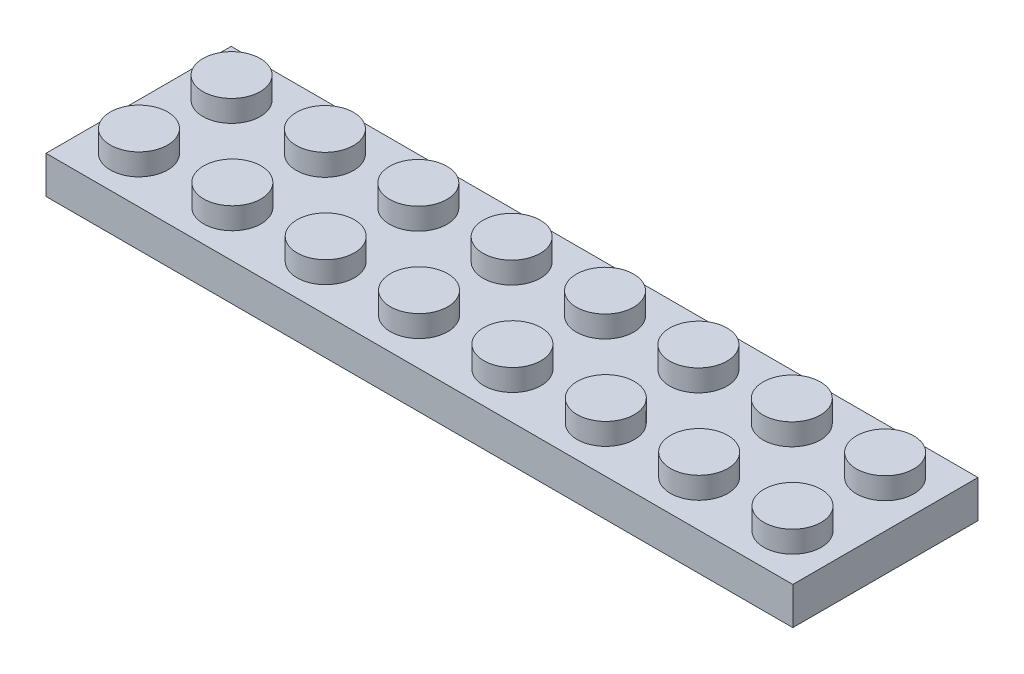
from build123d import *

# Parameters (mm, degrees)
SKETCH1_W           = 63.83
SKETCH1_H           = 15.83
BOSS_EXTRUDE1_DEPTH = 3.2
SKETCH2_R           = 2.45
BOSS_EXTRUDE2_DEPTH = 1.85
SHELL1_T            = -1.5
SKETCH3_R           = 3.24
SKETCH3_R_2         = 2.43
BOSS_EXTRUDE3_DEPTH = 1.5


with BuildPart() as part:
    # Sketch1 → Boss-Extrude1 (new body)
    with BuildSketch(Plane(origin=(0, 0, 0), x_dir=(1, 0, 0), z_dir=(0, 1, 0))):
        Rectangle(SKETCH1_W, SKETCH1_H)
    extrude(amount=-BOSS_EXTRUDE1_DEPTH)

    # Sketch2 → Boss-Extrude2 (add)
    with BuildSketch(Plane(origin=(0, 0, 0), x_dir=(1, 0, 0), z_dir=(0, 1, 0))):
        with Locations(Location((-27.925625, 3.9575, 0), (0, 0, 270))):
            Circle(SKETCH2_R)
        with Locations(Location((-19.945625, 3.9575, 0), (0, 0, 270))):
            Circle(SKETCH2_R)
        with Locations(Location((-11.965625, 3.9575, 0), (0, 0, 270))):
            Circle(SKETCH2_R)
        with Locations(Location((-3.985625, 3.9575, 0), (0, 0, 270))):
            Circle(SKETCH2_R)
        with Locations(Location((3.994375, 3.9575, 0), (0, 0, 270))):
            Circle(SKETCH2_R)
        with Locations(Location((11.974375, 3.9575, 0), (0, 0, 270))):
            Circle(SKETCH2_R)
        with Locations(Location((19.954375, 3.9575, 0), (0, 0, 270))):
            Circle(SKETCH2_R)
        with Locations(Location((27.934375, 3.9575, 0), (0, 0, 270))):
            Circle(SKETCH2_R)
        with Locations(Location((27.934375, -3.9575, 0), (0, 0, 90))):
            Circle(SKETCH2_R)
        with Locations(Location((19.954375, -3.9575, 0), (0, 0, 90))):
            Circle(SKETCH2_R)
        with Locations(Location((11.974375, -3.9575, 0), (0, 0, 90))):
            Circle(SKETCH2_R)
        with Locations(Location((3.994375, -3.9575, 0), (0, 0, 90))):
            Circle(SKETCH2_R)
        with Locations(Location((-3.985625, -3.9575, 0), (0, 0, 90))):
            Circle(SKETCH2_R)
        with Locations(Location((-11.965625, -3.9575, 0), (0, 0, 90))):
            Circle(SKETCH2_R)
        with Locations(Location((-19.945625, -3.9575, 0), (0, 0, 90))):
            Circle(SKETCH2_R)
        with Locations(Location((-27.925625, -3.9575, 0), (0, 0, 90))):
            Circle(SKETCH2_R)
    extrude(amount=BOSS_EXTRUDE2_DEPTH)

    # Shell1
    shell1_openings = [part.faces().sort_by_distance(p)[0] for p in [
        (0, -3.2, 0),
    ]]
    offset(amount=SHELL1_T, openings=shell1_openings, kind=Kind.INTERSECTION)

    # Sketch3 → Boss-Extrude3 (add)
    # profile 1 of 7: a face of its own
    with BuildSketch(Plane.XZ.offset(1.5)):
        with Locations(Location((-23.93625, 0, 0), (0, 0, 90))):
            Circle(SKETCH3_R)
        with Locations(Location((-23.93625, 0, 0), (0, 0, 90))):
            Circle(SKETCH3_R_2, mode=Mode.SUBTRACT)
    # profile 2 of 7: a face of its own
    with BuildSketch(Plane.XZ.offset(1.5)):
        with Locations(Location((-15.95625, 0, 0), (0, 0, 90))):
            Circle(SKETCH3_R)
        with Locations(Location((-15.95625, 0, 0), (0, 0, 90))):
            Circle(SKETCH3_R_2, mode=Mode.SUBTRACT)
    # profile 3 of 7: a face of its own
    with BuildSketch(Plane.XZ.offset(1.5)):
        with Locations(Location((-7.97625, 0, 0), (0, 0, 90))):
            Circle(SKETCH3_R)
        with Locations(Location((-7.97625, 0, 0), (0, 0, 90))):
            Circle(SKETCH3_R_2, mode=Mode.SUBTRACT)
    # profile 4 of 7: a face of its own
    with BuildSketch(Plane.XZ.offset(1.5)):
        with Locations(Location((0.00375, 0, 0), (0, 0, 90))):
            Circle(SKETCH3_R)
        with Locations(Location((0.00375, 0, 0), (0, 0, 90))):
            Circle(SKETCH3_R_2, mode=Mode.SUBTRACT)
    # profile 5 of 7: a face of its own
    with BuildSketch(Plane.XZ.offset(1.5)):
        with Locations(Location((7.98375, 0, 0), (0, 0, 90))):
            Circle(SKETCH3_R)
        with Locations(Location((7.98375, 0, 0), (0, 0, 90))):
            Circle(SKETCH3_R_2, mode=Mode.SUBTRACT)
    # profile 6 of 7: a face of its own
    with BuildSketch(Plane.XZ.offset(1.5)):
        with Locations(Location((15.96375, 0, 0), (0, 0, 90))):
            Circle(SKETCH3_R)
        with Locations(Location((15.96375, 0, 0), (0, 0, 90))):
            Circle(SKETCH3_R_2, mode=Mode.SUBTRACT)
    # profile 7 of 7: a face of its own
    with BuildSketch(Plane.XZ.offset(1.5)):
        with Locations(Location((23.94375, 0, 0), (0, 0, 90))):
            Circle(SKETCH3_R)
        with Locations(Location((23.94375, 0, 0), (0, 0, 90))):
            Circle(SKETCH3_R_2, mode=Mode.SUBTRACT)
    extrude(amount=BOSS_EXTRUDE3_DEPTH)


solid = part.part
